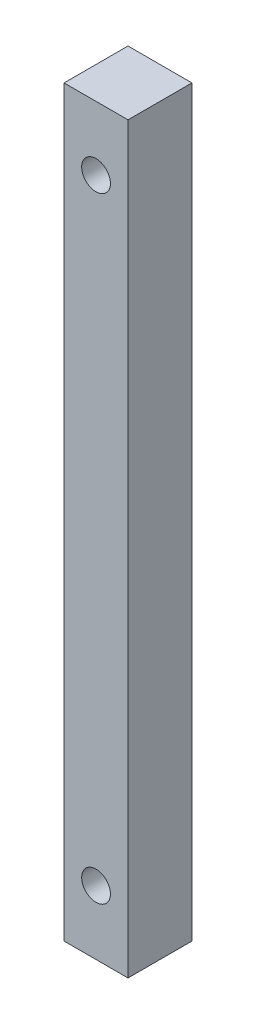
from build123d import *

# Parameters (mm, degrees)
SKETCH1_W           = 5.08
SKETCH1_H           = 59.05498984
SKETCH1_R           = 1.143
BOSS_EXTRUDE1_DEPTH = 5.08


with BuildPart() as part:
    # Sketch1 → Boss-Extrude1 (new body)
    with BuildSketch(Plane.XY):
        with Locations((2.54, -29.52749492)):
            Rectangle(SKETCH1_W, SKETCH1_H)
        with Locations((2.54, -5.08)):
            Circle(SKETCH1_R, mode=Mode.SUBTRACT)
        with Locations((2.54, -53.97498984)):
            Circle(SKETCH1_R, mode=Mode.SUBTRACT)
    extrude(amount=BOSS_EXTRUDE1_DEPTH)


solid = part.part
